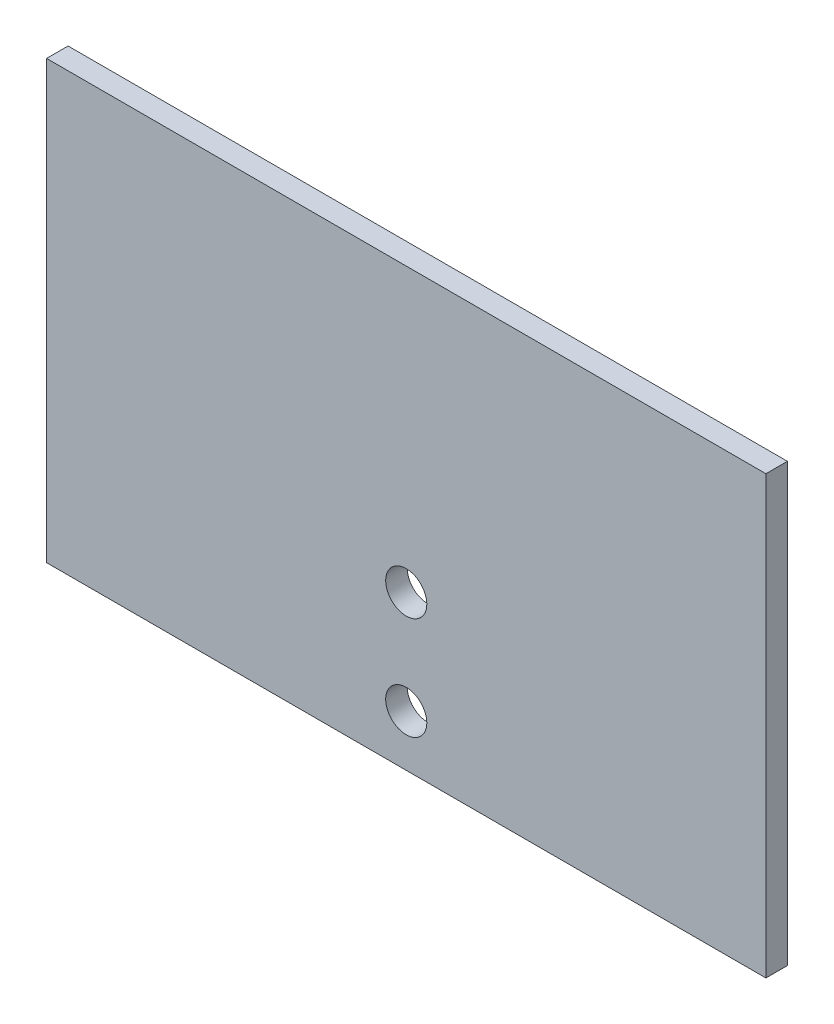
from build123d import *

# Parameters (mm, degrees)
SKETCH1_W           = 88.9
SKETCH1_H           = 53.975
BOSS_EXTRUDE1_DEPTH = 2.65684
SKETCH2_R           = 2.54
CUT_EXTRUDE1_DEPTH  = 105.036385096


with BuildPart() as part:
    # Sketch1 → Boss-Extrude1 (new body)
    with BuildSketch(Plane.XY):
        with Locations((44.45, 26.9875)):
            Rectangle(SKETCH1_W, SKETCH1_H)
    extrude(amount=BOSS_EXTRUDE1_DEPTH)

    # Sketch2 → Cut-Extrude1 (cut, through all)
    with BuildSketch(Plane.XY.offset(2.65684)):
        with Locations((44.45, 6.35)):
            Circle(SKETCH2_R)
        with Locations((44.45, 19.05)):
            Circle(SKETCH2_R)
    extrude(amount=-CUT_EXTRUDE1_DEPTH, mode=Mode.SUBTRACT)


solid = part.part
